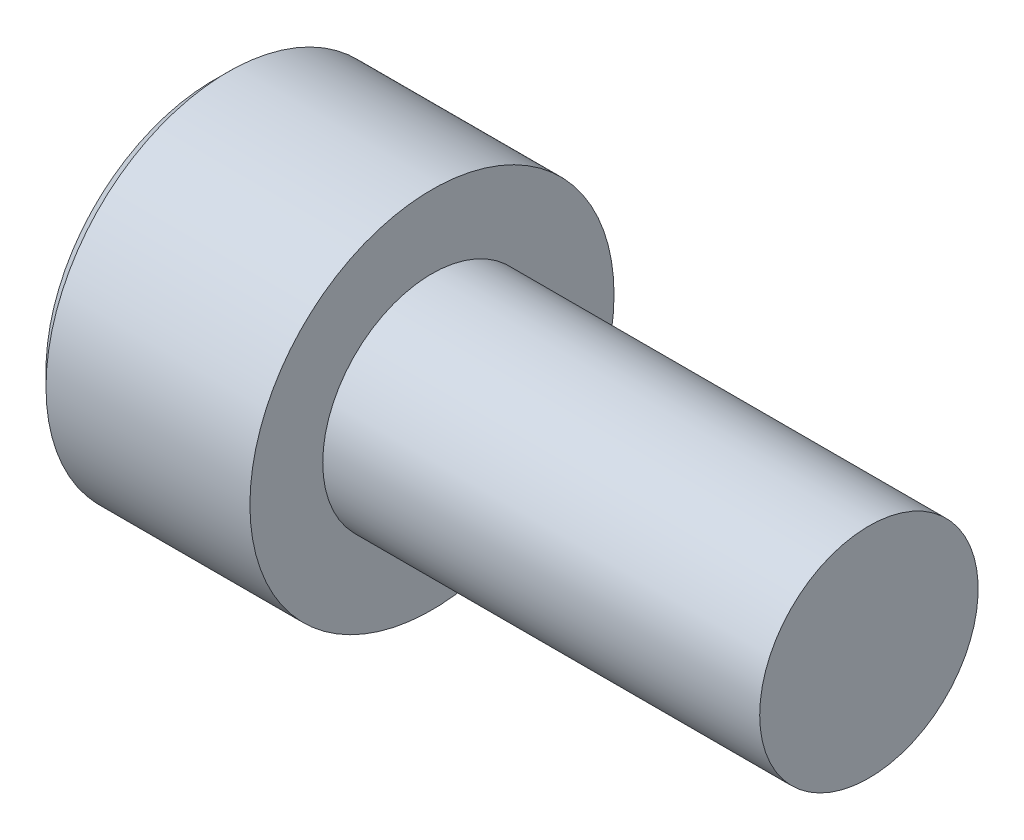
from build123d import *

# Parameters (mm, degrees)
CUT_EXTRUDE1_DEPTH = 3
CHAMFER1_SIZE      = 0.4


with BuildPart() as part:
    # Sketch1 → Revolve1 (revolve)
    with BuildSketch(Plane.XY, mode=Mode.PRIVATE) as revolve1_sk:
        Polygon((-6, 0), (12, 0), (12, 3), (0, 3), (0, 5), (-6, 5), align=None)
    revolve(revolve1_sk.sketch.rotate(Axis((-6, 0, 0), (1, 0, 0)), 90), axis=Axis((-6, 0, 0), (1, 0, 0)))

    # Sketch2 → Cut-Revolve1 (revolve, cut)
    with BuildSketch(Plane.XY, mode=Mode.PRIVATE) as cut_revolve1_sk:
        Polygon((-6, 0), (-1.556624327, 0), (-3, 2.5), (-6, 2.5), align=None)
    revolve(cut_revolve1_sk.sketch.rotate(Axis((-1.556624327, 0, 0), (1, 0, 0)), 90), axis=Axis((-1.556624327, 0, 0), (1, 0, 0)), mode=Mode.SUBTRACT)

    # Sketch3 → Cut-Extrude1 (cut)
    with BuildSketch(Plane.ZY.offset(6)):
        Polygon((2.886751346, 0), (1.443375673, 2.5), (-1.443375673, 2.5), (-2.886751346, 0), (-1.443375673, -2.5), (1.443375673, -2.5), align=None)
    extrude(amount=-CUT_EXTRUDE1_DEPTH, mode=Mode.SUBTRACT)

    # Chamfer1
    chamfer1_edges = [part.edges().sort_by_distance(p)[0] for p in [
        (-6, 0, -5),
    ]]
    chamfer(chamfer1_edges, length=CHAMFER1_SIZE)


solid = part.part
